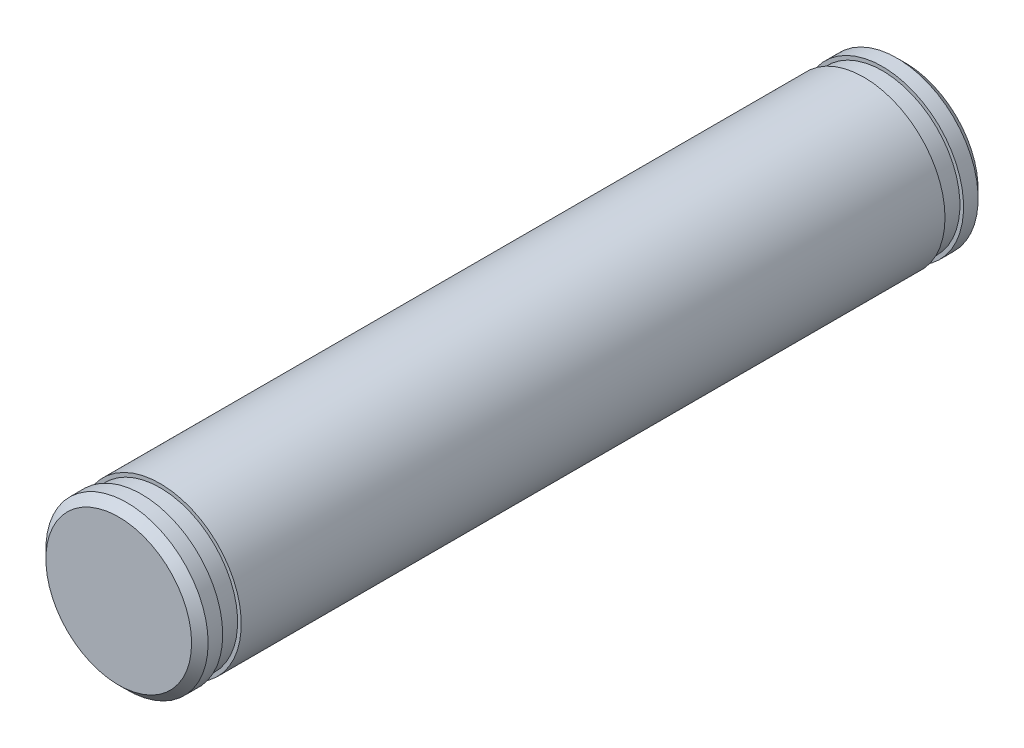
from build123d import *

# Parameters (mm, degrees)
SKETCH1_W     = 60.325
SKETCH1_H     = 6.223
SKETCH2_W     = 1.4224
SKETCH2_H     = 0.8128
CHAMFER1_SIZE = 0.635


with BuildPart() as part:
    # Sketch1 → Revolve1 (revolve)
    with BuildSketch(Plane(origin=(0, 0, 0), x_dir=(0, 0, -1), z_dir=(1, 0, 0))):
        with Locations((30.1625, 3.1115)):
            Rectangle(SKETCH1_W, SKETCH1_H)
    revolve(axis=Axis((0, 0, 0), (0, 0, 1)))

    # Sketch2 → Cut-Revolve1 (revolve, cut)
    with BuildSketch(Plane(origin=(0, 0, 0), x_dir=(0, 0, -1), z_dir=(1, 0, 0))):
        with Locations((2.4638, 6.35)):
            Rectangle(SKETCH2_W, SKETCH2_H)
        with Locations((57.8612, 6.35)):
            Rectangle(SKETCH2_W, SKETCH2_H)
    revolve(axis=Axis((0, 0, 0), (0, 0, 1)), mode=Mode.SUBTRACT)

    # Chamfer1
    chamfer1_edges = [part.edges().sort_by_distance(p)[0] for p in [
        (0, -6.223, -60.325),
        (0, -6.223, 0),
    ]]
    chamfer(chamfer1_edges, length=CHAMFER1_SIZE)


solid = part.part
